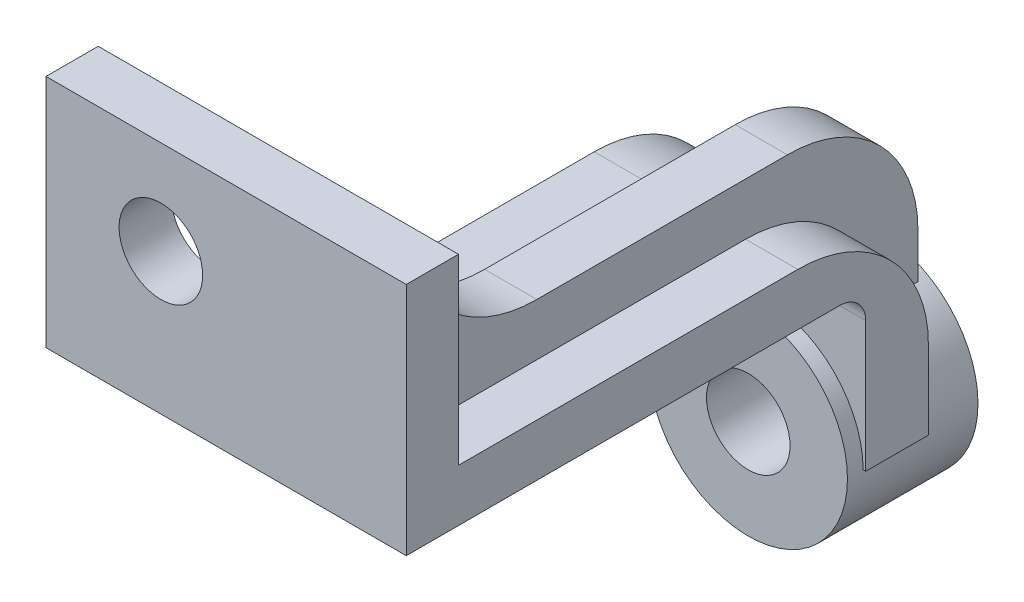
from build123d import *

# Parameters (mm, degrees)
IZIM1_W                     = 69
IZIM1_H                     = 45
IZIM1_R                     = 8
Y_KSEKLIK_EKSTR_ZYON1_DEPTH = 10
Y_KSEKLIK_EKSTR_ZYON2_DEPTH = 69
RADYUS1_R                   = 5
KES_EKSTR_ZYON2_DEPTH       = 57
IZIM6_R                     = 19
Y_KSEKLIK_EKSTR_ZYON3_DEPTH = 10
Y_KSEKLIK_EKSTR_ZYON4_START = 3
IZIM7_R                     = 19
Y_KSEKLIK_EKSTR_ZYON4_DEPTH = 3
Y_KSEKLIK_EKSTR_ZYON5_DEPTH = 10
KES_EKSTR_ZYON3_REACH       = 137.656
IZIM10_R                    = 8
RADYUS3_R                   = 25
RADYUS4_R                   = 25


with BuildPart() as part:
    # Çizim1 → Yükseklik-Ekstrüzyon1 (new body)
    with BuildSketch(Plane.XY):
        Rectangle(IZIM1_W, IZIM1_H)
        with Locations((-12.5, 4.5)):
            Circle(IZIM1_R, mode=Mode.SUBTRACT)
    extrude(amount=Y_KSEKLIK_EKSTR_ZYON1_DEPTH)

    # Çizim2 → Yükseklik-Ekstrüzyon2 (add)
    with BuildSketch(Plane(origin=(34.5, 0, 0), x_dir=(0, 0, -1), z_dir=(1, 0, 0))):
        Polygon((0, -12.5), (90, -12.5), (90, -52.5), (78, -52.5), (78, -22.5), (0, -22.5), align=None)
    extrude(amount=-Y_KSEKLIK_EKSTR_ZYON2_DEPTH)

    # Radyus1
    radyus1_edges = [part.edges().sort_by_distance(p)[0] for p in [
        (0, -22.5, -78),
    ]]
    fillet(radyus1_edges, radius=RADYUS1_R)

    # Çizim4 → Kes-Ekstrüzyon2 (cut)
    with BuildSketch(Plane(origin=(0, -12.5, 0), x_dir=(1, 0, 0), z_dir=(0, 1, 0))):
        with BuildLine():
            ThreePointArc((-34.5, 0), (-13.286796564, 8.786796564), (-4.5, 30))
            Line((-4.5, 30), (-4.5, 90))
            Line((-4.5, 90), (-34.5, 90))
            Line((-34.5, 90), (-34.5, 0))
        make_face()
        with BuildLine():
            ThreePointArc((-62.385076525, 41.064470488), (-59.318683634, 13.146723088), (-34.5, 0))
            Line((-34.5, 0), (-34.5, 90))
            Line((-34.5, 90), (-58.233748988, 48.34963648))
            Line((-58.233748988, 48.34963648), (-62.385076525, 41.064470488))
        make_face()
    extrude(amount=-KES_EKSTR_ZYON2_DEPTH, mode=Mode.SUBTRACT)

    # Çizim6 → Yükseklik-Ekstrüzyon3 (add)
    with BuildSketch(Plane(origin=(0, 0, -90), x_dir=(-1, 0, 0), z_dir=(0, 0, -1))):
        with Locations((-15, -52.5)):
            Circle(IZIM6_R)
    extrude(amount=Y_KSEKLIK_EKSTR_ZYON3_DEPTH)

    # Çizim7 → Yükseklik-Ekstrüzyon4 (add)
    with BuildSketch(Plane.XY.offset(-78).offset(Y_KSEKLIK_EKSTR_ZYON4_START)):
        with Locations(Location((15, -52.5, 0), (0, 0, 180))):
            Circle(IZIM7_R)
    extrude(amount=-Y_KSEKLIK_EKSTR_ZYON4_DEPTH)

    # loft from a face of the part (loft1)
    loft([part.faces().sort_by_distance((15, -60.56385045, -90))[0], part.faces().sort_by_distance((15, -60.56385045, -78))[0]])

    # Çizim15 → Yükseklik-Ekstrüzyon5 (add)
    with BuildSketch(Plane(origin=(24.5, 0, 0), x_dir=(0, 0, -1), z_dir=(1, 0, 0))):
        with BuildLine():
            Line((0, 22.5), (0, -12.5))
            Line((0, -12.5), (90, -12.5))
            Line((90, -12.5), (90, -52.5))
            Line((90, -52.5), (98, -52.5))
            Line((98, -52.5), (98, -46.937300736))
            Line((98, -46.937300736), (98, -2.5))
            Line((98, -2.5), (25, -2.5))
            ThreePointArc((25, -2.5), (7.32233047, 4.82233047), (0, 22.5))
        make_face()
    extrude(amount=-Y_KSEKLIK_EKSTR_ZYON5_DEPTH)

    # Çizim10 → Kes-Ekstrüzyon3 (cut, up to next)
    with BuildSketch(Plane(origin=(0, 0, -100), x_dir=(-1, 0, 0), z_dir=(0, 0, -1)), mode=Mode.PRIVATE) as kes_ekstr_zyon3_sk1:
        with Locations((-15, -52.5)):
            Circle(IZIM10_R)
    kes_ekstr_zyon3_tool1 = extrude(kes_ekstr_zyon3_sk1.sketch, amount=-KES_EKSTR_ZYON3_REACH, mode=Mode.PRIVATE) & part.part
    add(kes_ekstr_zyon3_tool1.solids().sort_by_distance((15, -52.5, -100))[0], mode=Mode.SUBTRACT)

    # Radyus3
    radyus3_edges = [part.edges().sort_by_distance(p)[0] for p in [
        (19.5, -2.5, -98),
    ]]
    fillet(radyus3_edges, radius=RADYUS3_R)

    # Radyus4
    radyus4_edges = [part.edges().sort_by_distance(p)[0] for p in [
        (29.5, -12.5, -90),
        (5, -12.5, -90),
    ]]
    fillet(radyus4_edges, radius=RADYUS4_R)


solid = part.part
